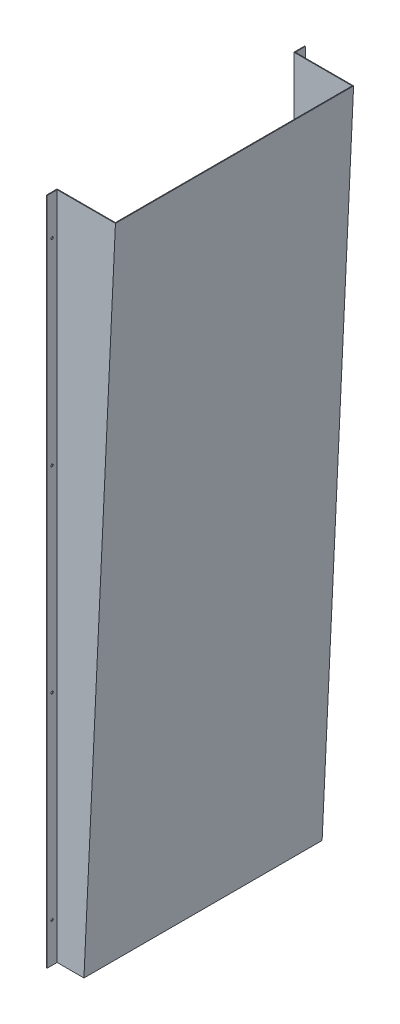
from build123d import *

# Parameters (mm, degrees)
BOSS_EXTRUDE1_DEPTH = 302.5
SHELL1_T            = -1.8
CUT_EXTRUDE4_REACH  = 1730.332
SKETCH22_W          = 148.11330214
SKETCH22_H          = 601.4
CUT_EXTRUDE5_REACH  = 1728.561
SKETCH23_W          = 68.282713905
SKETCH23_H          = 601.4
SKETCH24_W          = 25.4
SKETCH24_H          = 1700
BOSS_EXTRUDE2_DEPTH = 1.8
SKETCH25_R          = 3
CUT_EXTRUDE6_DEPTH  = 10


with BuildPart() as part:
    # Sketch21 → Boss-Extrude1 (new, symmetric)
    with BuildSketch(Plane.XY):
        Polygon((-75, -850), (-75, 850), (75, 850), (-5, -850), align=None)
    extrude(amount=BOSS_EXTRUDE1_DEPTH, both=True)

    # Shell1
    shell1_openings = [part.faces().sort_by_distance(p)[0] for p in [
        (-75, 0, 0),
    ]]
    offset(amount=SHELL1_T, openings=shell1_openings, kind=Kind.INTERSECTION)

    # Sketch22 → Cut-Extrude4 (cut, up to next)
    with BuildSketch(Plane(origin=(0, 850, 0), x_dir=(1, 0, 0), z_dir=(0, 1, 0)), mode=Mode.PRIVATE) as cut_extrude4_sk1:
        with Locations((-0.94334893, 0)):
            Rectangle(SKETCH22_W, SKETCH22_H)
    cut_extrude4_tool1 = extrude(cut_extrude4_sk1.sketch, amount=-CUT_EXTRUDE4_REACH, mode=Mode.PRIVATE) & part.part
    add(cut_extrude4_tool1.solids().sort_by_distance((-0.943349, 850, 0))[0], mode=Mode.SUBTRACT)

    # Sketch23 → Cut-Extrude5 (cut, up to next)
    with BuildSketch(Plane(origin=(0, -848.2, 0), x_dir=(1, 0, 0), z_dir=(0, 1, 0)), mode=Mode.PRIVATE) as cut_extrude5_sk1:
        with Locations((-40.858643048, 0)):
            Rectangle(SKETCH23_W, SKETCH23_H)
    cut_extrude5_tool1 = extrude(cut_extrude5_sk1.sketch, amount=-CUT_EXTRUDE5_REACH, mode=Mode.PRIVATE) & part.part
    add(cut_extrude5_tool1.solids().sort_by_distance((-40.858643, -848.2, 0))[0], mode=Mode.SUBTRACT)

    # Sketch24 → Boss-Extrude2 (add)
    with BuildSketch(Plane.ZY.offset(75)):
        with Locations((-315.2, 0)):
            Rectangle(SKETCH24_W, SKETCH24_H)
        with Locations((315.2, 0)):
            Rectangle(SKETCH24_W, SKETCH24_H)
    extrude(amount=-BOSS_EXTRUDE2_DEPTH)

    # Sketch25 → Cut-Extrude6 (cut)
    with BuildSketch(Plane(origin=(-73.2, 0, 0), x_dir=(0, 0, -1), z_dir=(1, 0, 0))):
        with Locations(Location((-315.2, 750, 0), (0, 0, 90))):
            Circle(SKETCH25_R)
        with Locations(Location((-315.2, 250, 0), (0, 0, 90))):
            Circle(SKETCH25_R)
        with Locations(Location((-315.2, -250, 0), (0, 0, 90))):
            Circle(SKETCH25_R)
        with Locations(Location((-315.2, -750, 0), (0, 0, 90))):
            Circle(SKETCH25_R)
    cut_extrude6 = extrude(amount=-CUT_EXTRUDE6_DEPTH, mode=Mode.SUBTRACT)

    # Mirror1: Cut-Extrude6 across plane
    add(cut_extrude6.mirror(Plane.XY), mode=Mode.SUBTRACT)


solid = part.part
